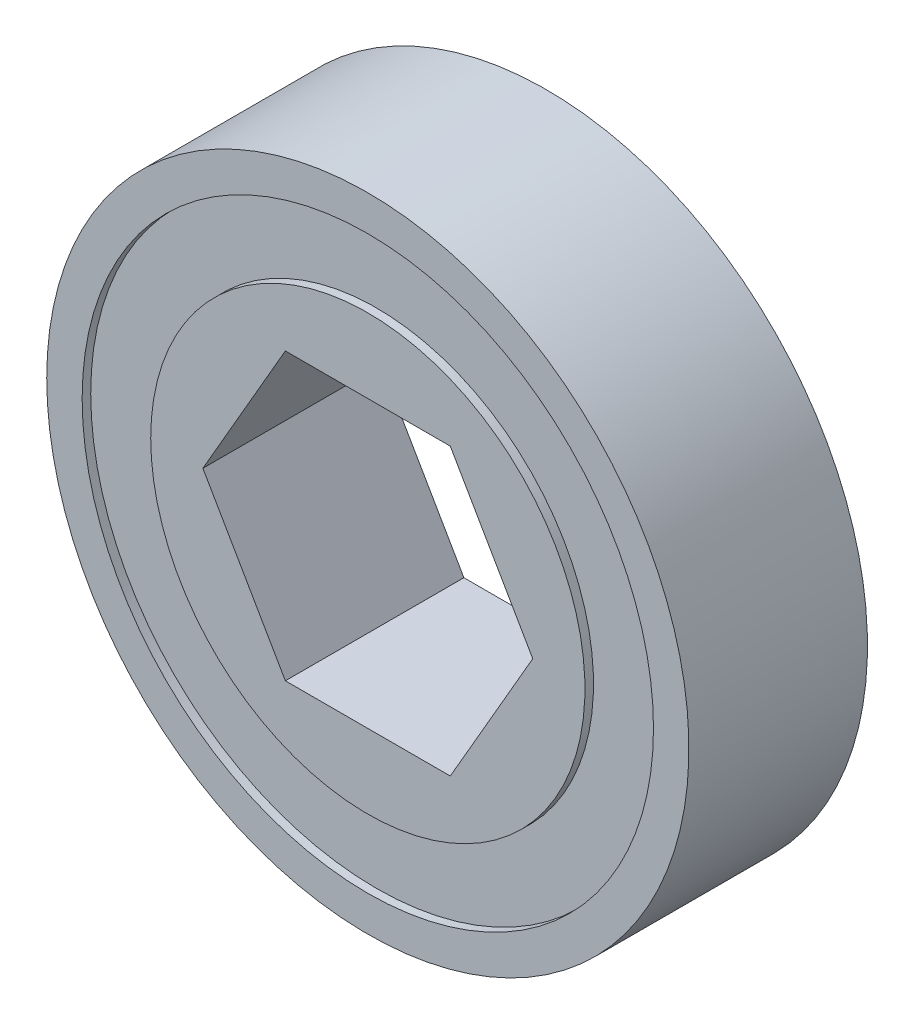
from build123d import *

# Parameters (mm, degrees)
CUT_EXTRUDE6_DEPTH      = 22.692020107
CUT_EXTRUDE6_DEPTH_BACK = 22.692020107


with BuildPart() as part:
    # Sketch11 → Revolve3 (revolve)
    with BuildSketch(Plane(origin=(0, 0, 0), x_dir=(1, 0, 0), z_dir=(0, 1, 0))):
        Polygon((14.2748, -7.9375), (14.2748, -2.4010112), (14.2748, 0), (12.7, 0), (12.7, -0.381), (9.652, -0.381), (9.652, 0), (0, 0), (0, -7.9375), (9.652, -7.9375), (9.652, -7.5565), (12.7, -7.5565), (12.7, -7.9375), align=None)
    revolve(axis=Axis((0, 0, 0.717728402), (0, 0, 1)))

    # Sketch12 → Cut-Extrude6 (cut, two sides: drawn at the far end of the back side and taken through both)
    with BuildSketch(Plane(origin=(0, 0, 0), x_dir=(-1, 0, 0), z_dir=(0, 0, 1)).offset(-CUT_EXTRUDE6_DEPTH_BACK)):
        Polygon((7.332348419, 0), (3.666174209, 6.35), (-3.666174209, 6.35), (-7.332348419, 0), (-3.666174209, -6.35), (3.666174209, -6.35), align=None)
    extrude(amount=CUT_EXTRUDE6_DEPTH + CUT_EXTRUDE6_DEPTH_BACK, mode=Mode.SUBTRACT)


solid = part.part
